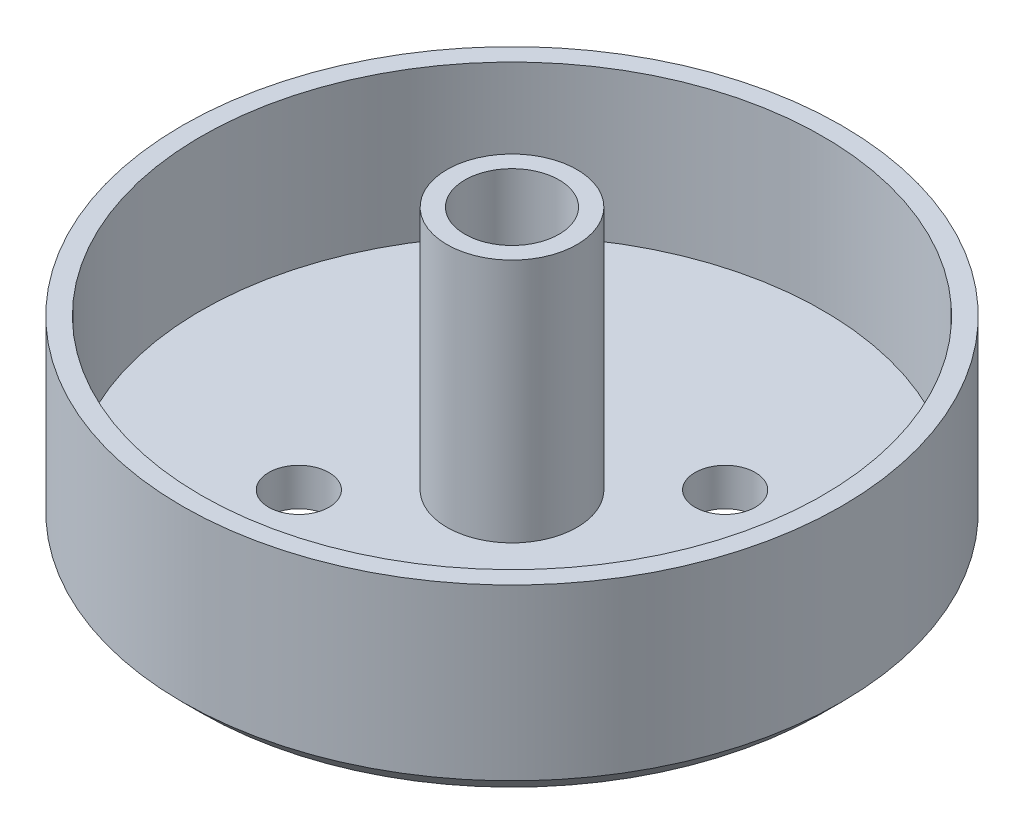
from build123d import *

# Parameters (mm, degrees)
SKETCH1_R          = 17.5
SKETCH1_R_2        = 2.5
BODY_DEPTH         = 2
SKETCH4_R          = 3.45
SKETCH4_R_2        = 2.5
SHAFT_DEPTH        = 13
SKETCH5_R          = 17.5
SKETCH5_R_2        = 16.5
BORDER_DEPTH       = 8
SKETCH3_R          = 1.6
SCREW_HOLES_DEPTH  = 3
SCREW_CHAMFER_SIZE = 1


with BuildPart() as part:
    # Sketch1 → Body (new body)
    with BuildSketch(Plane(origin=(0, 0, 0), x_dir=(1, 0, 0), z_dir=(0, 1, 0))):
        with Locations(Location((0, 0, 0), (0, 0, 270))):
            Circle(SKETCH1_R)
        with Locations(Location((0, 0, 0), (0, 0, 270))):
            Circle(SKETCH1_R_2, mode=Mode.SUBTRACT)
    extrude(amount=BODY_DEPTH)

    # Sketch4 → Shaft (add)
    with BuildSketch(Plane(origin=(0, 2, 0), x_dir=(1, 0, 0), z_dir=(0, 1, 0))):
        with Locations(Location((0, 0, 0), (0, 0, 270))):
            Circle(SKETCH4_R)
        with Locations(Location((0, 0, 0), (0, 0, 270))):
            Circle(SKETCH4_R_2, mode=Mode.SUBTRACT)
    extrude(amount=SHAFT_DEPTH)

    # Sketch5 → Border (add)
    with BuildSketch(Plane(origin=(0, 2, 0), x_dir=(1, 0, 0), z_dir=(0, 1, 0))):
        with Locations(Location((0, 0, 0), (0, 0, 270))):
            Circle(SKETCH5_R)
        with Locations(Location((0, 0, 0), (0, 0, 270))):
            Circle(SKETCH5_R_2, mode=Mode.SUBTRACT)
    extrude(amount=BORDER_DEPTH)

    # Sketch3 → Screw holes (cut)
    with BuildSketch(Plane(origin=(0, 0, 0), x_dir=(-1, 0, 0), z_dir=(0, -1, 0))):
        with Locations(Location((5.656854249, 5.656854249, 0), (0, 0, 90))):
            Circle(SKETCH3_R)
        with Locations(Location((5.656854249, -5.656854249, 0), (0, 0, 90))):
            Circle(SKETCH3_R)
        with Locations(Location((-5.656854249, -5.656854249, 0), (0, 0, 90))):
            Circle(SKETCH3_R)
        with Locations(Location((-5.656854249, 5.656854249, 0), (0, 0, 90))):
            Circle(SKETCH3_R)
    extrude(amount=-SCREW_HOLES_DEPTH, mode=Mode.SUBTRACT)

    # Screw chamfer
    screw_chamfer_edges = [part.edges().sort_by_distance(p)[0] for p in [
        (0, 0, -17.5),
    ]]
    chamfer(screw_chamfer_edges, length=SCREW_CHAMFER_SIZE)


solid = part.part
